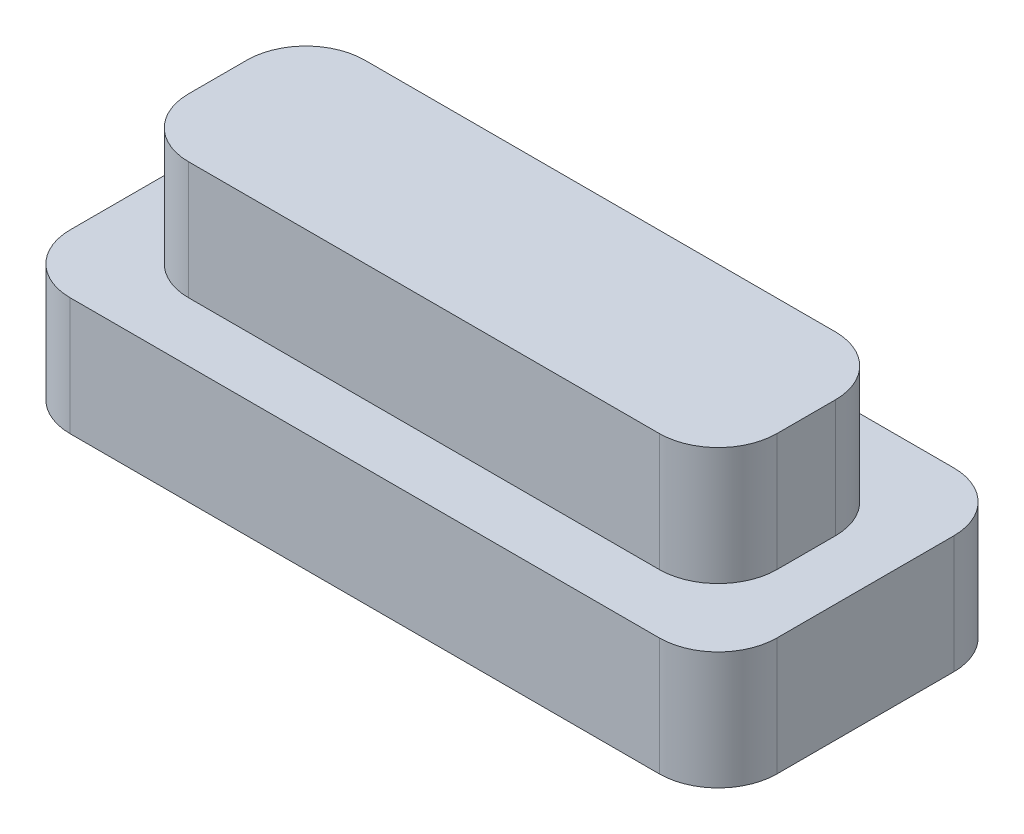
from build123d import *

# Parameters (mm, degrees)
BOSS_EXTRUDE1_DEPTH = 2
BOSS_EXTRUDE2_DEPTH = 2


with BuildPart() as part:
    # Sketch1 → Boss-Extrude1 (new body)
    with BuildSketch(Plane(origin=(0, 0, 0), x_dir=(1, 0, 0), z_dir=(0, 1, 0))):
        with BuildLine():
            Line((-5, 2.5), (5, 2.5))
            ThreePointArc((5, 2.5), (5.707106781, 2.207106781), (6, 1.5))
            Line((6, 1.5), (6, -1.5))
            ThreePointArc((6, -1.5), (5.707106781, -2.207106781), (5, -2.5))
            Line((5, -2.5), (-5, -2.5))
            ThreePointArc((-5, -2.5), (-5.707106781, -2.207106781), (-6, -1.5))
            Line((-6, -1.5), (-6, 1.5))
            ThreePointArc((-6, 1.5), (-5.707106781, 2.207106781), (-5, 2.5))
        make_face()
    extrude(amount=BOSS_EXTRUDE1_DEPTH)

    # Sketch2 → Boss-Extrude2 (add)
    with BuildSketch(Plane(origin=(0, 2, 0), x_dir=(1, 0, 0), z_dir=(0, 1, 0))):
        with BuildLine():
            Line((-3.995, 1.495), (3.995, 1.495))
            ThreePointArc((3.995, 1.495), (4.702106781, 1.202106781), (4.995, 0.495))
            Line((4.995, 0.495), (4.995, -0.495))
            ThreePointArc((4.995, -0.495), (4.702106781, -1.202106781), (3.995, -1.495))
            Line((3.995, -1.495), (-3.995, -1.495))
            ThreePointArc((-3.995, -1.495), (-4.702106781, -1.202106781), (-4.995, -0.495))
            Line((-4.995, -0.495), (-4.995, 0.495))
            ThreePointArc((-4.995, 0.495), (-4.702106781, 1.202106781), (-3.995, 1.495))
        make_face()
    extrude(amount=BOSS_EXTRUDE2_DEPTH)


solid = part.part
